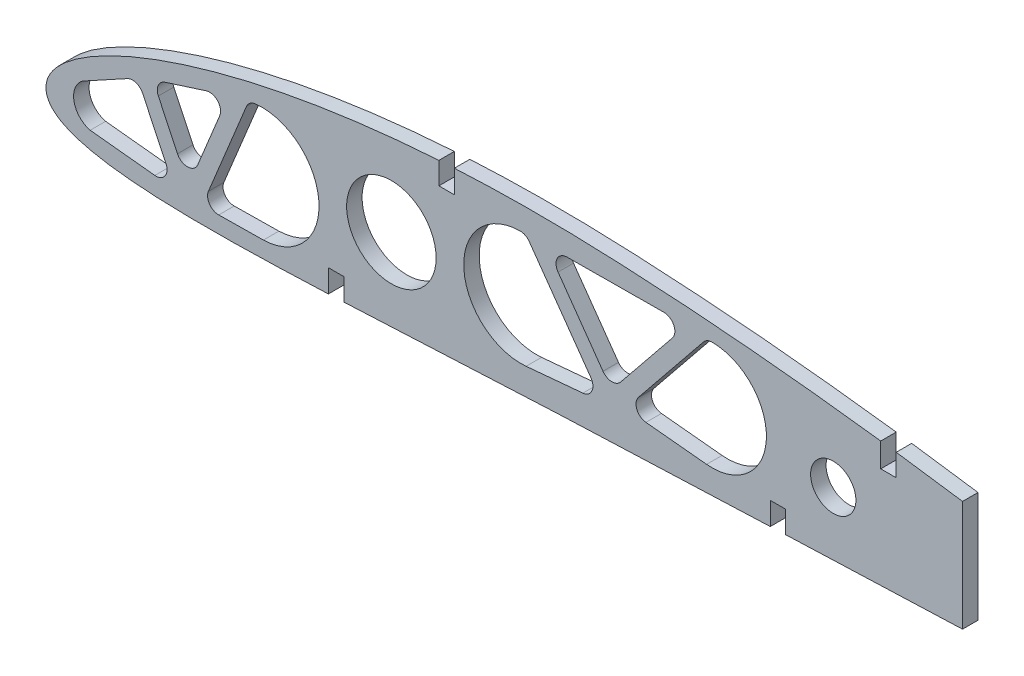
from build123d import *

# Parameters (mm, degrees)
SKETCH_2_R      = 8.1
SKETCH_2_R_2    = 4.1
EXTRUDE_2_DEPTH = 1.4


with BuildPart() as part:
    # Эскиз2 → Бобышка-Вытянуть2 (new, symmetric)
    with BuildSketch(Plane.XY):
        with BuildLine():
            Line((165.940456932, 7.493910357), (165.940456932, 18.08535451))
            add(Edge.make_bspline(
                [(165.940456927, 18.085354477), (165.930512982, 18.086853188), (163.740114219, 18.416932942), (159.739714866, 19.000386852), (155.744292591, 19.547112651), (153.932619318, 19.787470759)],
                knots=[0.332761263, 0.332761263, 0.332761263, 0.332761263, 0.332878042, 0.358484538, 0.379707003, 0.379707003, 0.379707003, 0.379707003], degree=3))
            Line((153.932619318, 19.787470759), (153.932619318, 15.787470759))
            Line((153.932619318, 15.787470759), (151.132619318, 15.787470759))
            Line((151.132619318, 15.787470759), (151.132619318, 20.152925753))
            add(Edge.make_bspline(
                [(151.132619318, 20.152925753), (149.51271539, 20.360855756), (145.712882211, 20.834305053), (139.731359791, 21.525676112), (133.19183673, 22.212004248), (126.658683026, 22.825721427), (120.136770918, 23.363973264), (113.62856714, 23.824677322), (107.152732037, 24.200242592), (100.741095693, 24.498399508), (94.411752715, 24.686649766), (88.155917993, 24.740095648), (81.949043055, 24.658849141), (77.212383792, 24.491578654), (74.545027167, 24.35694527), (73.932619318, 24.323871534)],
                knots=[0.390637302, 0.390637302, 0.390637302, 0.390637302, 0.409602822, 0.435103874, 0.460559416, 0.485959195, 0.51130307, 0.536551515, 0.561723366, 0.586628867, 0.611085431, 0.6352512, 0.659272176, 0.683163753, 0.690285585, 0.690285585, 0.690285585, 0.690285585], degree=3))
            Line((73.932619318, 24.323871534), (73.932619318, 20.157469486))
            Line((73.932619318, 20.157469486), (71.132619318, 20.157469486))
            Line((71.132619318, 20.157469486), (71.132619318, 24.157469486))
            add(Edge.make_bspline(
                [(71.132619318, 24.157469486), (70.635982629, 24.125241372), (68.110579653, 23.953963558), (63.575410502, 23.578006358), (57.555189551, 22.924946655), (51.605762689, 22.119065518), (45.744400312, 21.156564429), (39.995857594, 20.035371386), (34.397919843, 18.75631623), (29.010382104, 17.327615604), (23.925798409, 15.771864917), (19.27067884, 14.13426943), (15.179098392, 12.483335433), (11.740475791, 10.89561099), (8.959371869, 9.429577361), (6.760891181, 8.108603195), (5.033709749, 6.92463805), (3.671694934, 5.85422966), (2.592101124, 4.871305364), (1.738175669, 3.952595739), (1.069870831, 3.080946369), (0.571645411, 2.241622098), (0.2157739, 1.430785392), (0.102255582, 0.88324169), (0.047975001, 0.621424995)],
                knots=[0.701142916, 0.701142916, 0.701142916, 0.701142916, 0.706922144, 0.73053591, 0.7539832, 0.77723469, 0.800246382, 0.822950709, 0.845237155, 0.866915896, 0.887662335, 0.906968281, 0.924203157, 0.938878975, 0.950931611, 0.960693484, 0.968646729, 0.975232933, 0.980794744, 0.985583761, 0.989781539, 0.993521313, 0.996902113, 1, 1, 1, 1], degree=3))
            add(Edge.make_bspline(
                [(0.047975001, 0.621424995), (0.022713821, 0.373490081), (-0.027820788, -0.12249998), (0.077991213, -0.884434595), (0.349695651, -1.638838075), (0.814331136, -2.365068928), (1.463480781, -3.039275249), (2.290973018, -3.660999474), (3.305928751, -4.235779626), (4.53525562, -4.773674148), (6.029745689, -5.282192169), (7.868981216, -5.765316681), (10.168831393, -6.221716597), (13.07543819, -6.639618735), (16.728115364, -6.992956742), (21.189952097, -7.247345149), (26.399984417, -7.376638853), (32.197398565, -7.376256917), (38.39780676, -7.261436583), (44.752137938, -7.05998551), (49.023344092, -6.886827907), (51.132619318, -6.795360627)],
                knots=[0, 0, 0, 0, 0.002941446, 0.005884319, 0.00901613, 0.012364547, 0.016007934, 0.020036845, 0.024573728, 0.029783835, 0.03589701, 0.04324044, 0.052275965, 0.063634589, 0.077983176, 0.095698161, 0.116520086, 0.13966073, 0.16431217, 0.18991889, 0.214908072, 0.214908072, 0.214908072, 0.214908072], degree=3))
            Line((51.132619318, -6.795360627), (51.132619318, -2.670677263))
            Line((51.132619318, -2.670677263), (53.932619318, -2.670677263))
            Line((53.932619318, -2.670677263), (53.932619318, -6.670677263))
            add(Edge.make_bspline(
                [(53.932619318, -6.670677263), (55.356569482, -6.605720394), (59.058679651, -6.431131786), (65.052094606, -6.13285227), (71.91077271, -5.784005184), (78.771375577, -5.439680462), (85.61049861, -5.110951262), (92.43210759, -4.804953337), (99.255031191, -4.531981668), (106.097378406, -4.278274685), (112.969211681, -4.003089942), (119.864404255, -3.723176202), (125.92308308, -3.47492717), (129.679854903, -3.321735217), (131.132619318, -3.262735091)],
                knots=[0.225966113, 0.225966113, 0.225966113, 0.225966113, 0.242837762, 0.269833583, 0.296993022, 0.324123272, 0.351139107, 0.378035509, 0.404946016, 0.431960837, 0.459078395, 0.4863474, 0.51364083, 0.530850189, 0.530850189, 0.530850189, 0.530850189], degree=3))
            Line((131.132619318, -3.262735091), (131.132619318, 0.850647814))
            Line((131.132619318, 0.850647814), (133.932619318, 0.850647814))
            Line((133.932619318, 0.850647814), (133.932619318, -3.149352186))
            add(Edge.make_bspline(
                [(133.932619318, -3.149352186), (136.150252366, -3.05984138), (140.66441482, -2.879164577), (147.472013762, -2.613922958), (154.352602411, -2.355626415), (160.507662095, -2.135075484), (164.369425992, -2.00299999), (165.940456932, -1.950382964)],
                knots=[0.541906346, 0.541906346, 0.541906346, 0.541906346, 0.568176028, 0.595379569, 0.622543445, 0.64967326, 0.668278692, 0.668278692, 0.668278692, 0.668278692], degree=3))
            Line((165.940456932, -1.950382964), (165.940456932, 7.493910357))
        make_face()
        with BuildLine():
            ThreePointArc((14.721240391, 8.766081587), (16.29867531, 8.913940332), (17.488708089, 7.868002897))
            Line((17.488708089, 7.868002897), (21.725441093, -1.073266618))
            ThreePointArc((21.725441093, -1.073266618), (21.549996986, -3.085882804), (19.709418924, -3.918755509))
            Line((19.709418924, -3.918755509), (7.999391348, -2.690370853))
            ThreePointArc((7.999391348, -2.690370853), (5.078852056, 0.362162442), (6.580135706, 4.311042875))
            Line((6.580135706, 4.311042875), (14.721240391, 8.766081587))
        make_face(mode=Mode.SUBTRACT)
        with BuildLine():
            Line((23.813024955, 1.527110532), (20.342244628, 8.85190119))
            ThreePointArc((20.342244628, 8.85190119), (20.315234657, 10.50521233), (21.542097769, 11.613803404))
            Line((21.542097769, 11.613803404), (29.003823035, 13.992759157))
            ThreePointArc((29.003823035, 13.992759157), (31.082028751, 13.44264333), (31.461008962, 11.326528867))
            Line((31.461008962, 11.326528867), (27.470064023, 1.622782457))
            ThreePointArc((27.470064023, 1.622782457), (25.672695714, 0.384197539), (23.813024955, 1.527110532))
        make_face(mode=Mode.SUBTRACT)
        with BuildLine():
            ThreePointArc((31.277857225, -4.328453595), (29.59717908, -3.452864074), (29.401621993, -1.567898965))
            Line((29.401621993, -1.567898965), (36.28872379, 15.177681436))
            ThreePointArc((36.28872379, 15.177681436), (36.93262885, 16.01260855), (37.911651949, 16.404055587))
            ThreePointArc((37.911651949, 16.404055587), (49.40696202, 6.85120019), (39.366777065, -4.221012142))
            Line((39.366777065, -4.221012142), (31.277857225, -4.328453595))
        make_face(mode=Mode.SUBTRACT)
        with Locations((62.532619318, 8.596197208)):
            Circle(SKETCH_2_R, mode=Mode.SUBTRACT)
        with Locations((142.532619318, 8.596197208)):
            Circle(SKETCH_2_R_2, mode=Mode.SUBTRACT)
        with BuildLine():
            ThreePointArc((85.834710285, 20.440331448), (86.770100886, 20.22407123), (87.496942629, 19.59683512))
            Line((87.496942629, 19.59683512), (98.656957359, 3.846404038))
            ThreePointArc((98.656957359, 3.846404038), (98.841412786, 1.852917443), (97.205894504, 0.698321168))
            Line((97.205894504, 0.698321168), (86.928494978, -0.234664059))
            ThreePointArc((86.928494978, -0.234664059), (75.647085804, 9.534937552), (85.834710285, 20.440331448))
        make_face(mode=Mode.SUBTRACT)
        with BuildLine():
            ThreePointArc((108.623842739, 1.821697682), (106.976814232, 3.040567769), (107.26658781, 5.068960843))
            Line((107.26658781, 5.068960843), (119.042711354, 19.640469699))
            ThreePointArc((119.042711354, 19.640469699), (119.738361249, 20.189071191), (120.602738696, 20.383349351))
            ThreePointArc((120.602738696, 20.383349351), (130.419922424, 10.031300237), (119.603876283, 0.727797506))
            Line((119.603876283, 0.727797506), (108.623842739, 1.821697682))
        make_face(mode=Mode.SUBTRACT)
        with BuildLine():
            Line((100.847534604, 5.943867476), (92.710261403, 17.428221559))
            ThreePointArc((92.710261403, 17.428221559), (92.562400415, 19.496921566), (94.32837603, 20.584447529))
            Line((94.32837603, 20.584447529), (111.84428559, 20.7050059))
            ThreePointArc((111.84428559, 20.7050059), (113.659822033, 19.573166514), (113.413576859, 17.447937989))
            Line((113.413576859, 17.447937989), (104.034940499, 5.843025535))
            ThreePointArc((104.034940499, 5.843025535), (102.41617089, 5.101141005), (100.847534604, 5.943867476))
        make_face(mode=Mode.SUBTRACT)
    extrude(amount=EXTRUDE_2_DEPTH, both=True)


solid = part.part
